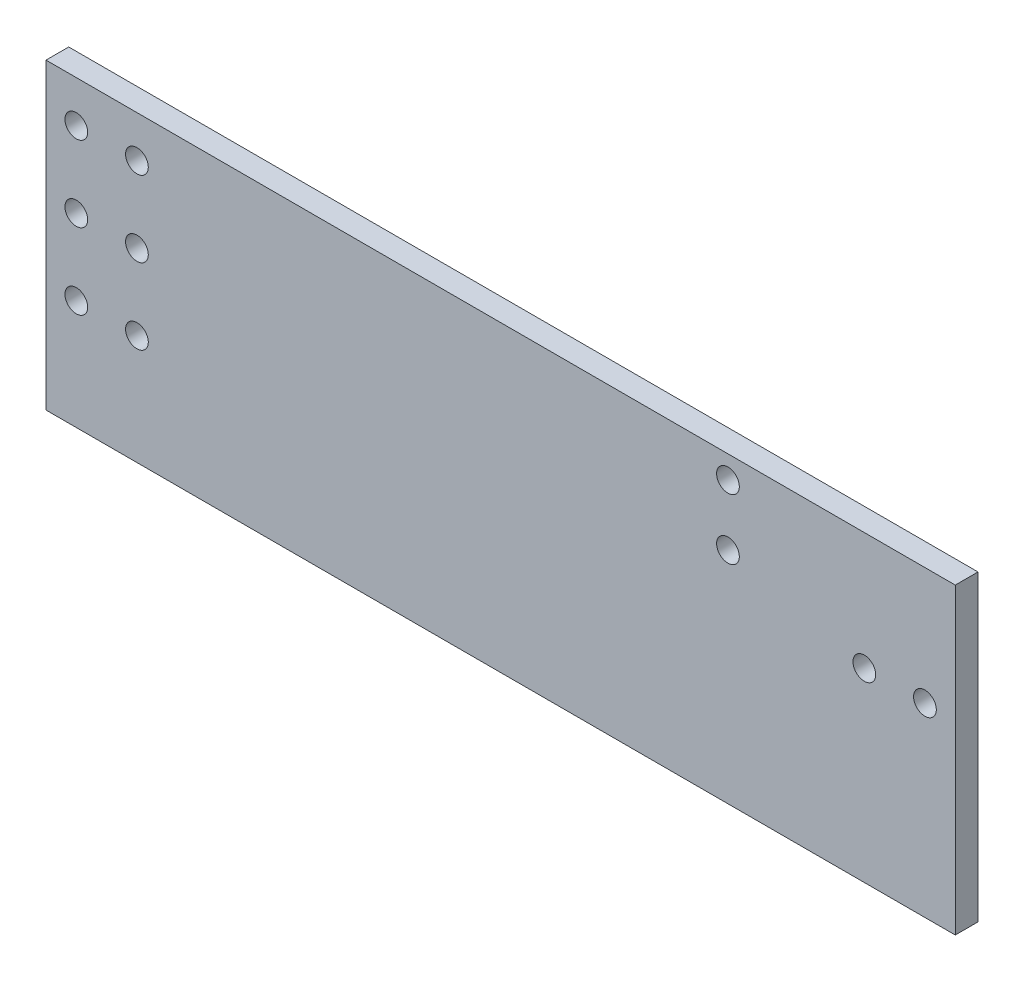
from build123d import *

# Parameters (mm, degrees)
SKETCH1_W           = 120
SKETCH1_H           = 55
SKETCH1_R           = 1.5
BOSS_EXTRUDE1_DEPTH = 3
CUT_EXTRUDE1_DEPTH  = 67.070038595
SKETCH3_W           = 120
SKETCH3_H           = 3
CUT_EXTRUDE2_DEPTH  = 67.070038595


with BuildPart() as part:
    # Sketch1 → Boss-Extrude1 (new body)
    with BuildSketch(Plane.XY):
        Rectangle(SKETCH1_W, SKETCH1_H)
        with Locations((30, 4.5)):
            Circle(SKETCH1_R, mode=Mode.SUBTRACT)
        with Locations((30, 12.5)):
            Circle(SKETCH1_R, mode=Mode.SUBTRACT)
        with Locations((56, 0)):
            Circle(SKETCH1_R, mode=Mode.SUBTRACT)
        with Locations((48, 0)):
            Circle(SKETCH1_R, mode=Mode.SUBTRACT)
        with Locations((-56, 10)):
            Circle(SKETCH1_R, mode=Mode.SUBTRACT)
        with Locations((-48, 10)):
            Circle(SKETCH1_R, mode=Mode.SUBTRACT)
        with Locations(Location((-56, -10, 0), (0, 0, 180))):
            Circle(SKETCH1_R, mode=Mode.SUBTRACT)
        with Locations(Location((-48, -10, 0), (0, 0, 180))):
            Circle(SKETCH1_R, mode=Mode.SUBTRACT)
        with Locations((-56, 0)):
            Circle(SKETCH1_R, mode=Mode.SUBTRACT)
        with Locations((-48, 0)):
            Circle(SKETCH1_R, mode=Mode.SUBTRACT)
    extrude(amount=BOSS_EXTRUDE1_DEPTH)

    # Sketch2 → Cut-Extrude1 (cut, through all)
    with BuildSketch(Plane.XY.offset(3)):
        Polygon((-60, 15.5), (60, 15.5), (60, 27.5), (-60, 27.514094308), (-60, 27.5), align=None)
    extrude(amount=-CUT_EXTRUDE1_DEPTH, mode=Mode.SUBTRACT)

    # Sketch3 → Cut-Extrude2 (cut, through all)
    with BuildSketch(Plane.XY.offset(3)):
        with Locations((0, -26)):
            Rectangle(SKETCH3_W, SKETCH3_H)
    extrude(amount=-CUT_EXTRUDE2_DEPTH, mode=Mode.SUBTRACT)


solid = part.part
